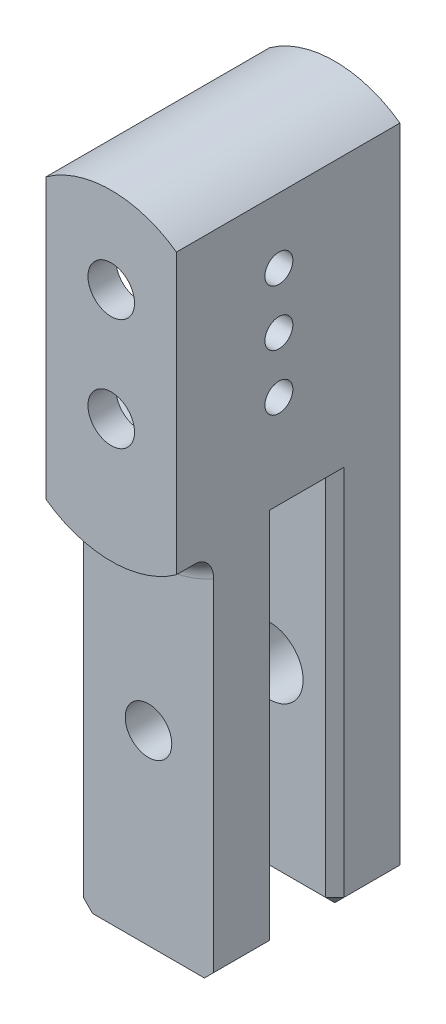
from build123d import *

# Parameters (mm, degrees)
SKETCH1_W           = 7
SKETCH1_H           = 35
BOSS_EXTRUDE1_DEPTH = 3.5
SKETCH2_W           = 7
SKETCH2_H           = 15
BOSS_EXTRUDE2_DEPTH = 3
SKETCH3_W           = 7
SKETCH3_H           = 35
BOSS_EXTRUDE3_DEPTH = 3.5
SKETCH4_W           = 7
SKETCH4_H           = 15
BOSS_EXTRUDE4_DEPTH = 2
SKETCH5_W           = 7
SKETCH5_H           = 9
CUT_EXTRUDE1_DEPTH  = 5.5
CUT_EXTRUDE2_REACH  = 39.407
SKETCH6_R           = 0.75
CUT_EXTRUDE3_REACH  = 39.656
SKETCH7_R           = 1.25
BOSS_EXTRUDE5_DEPTH = 12
BOSS_EXTRUDE6_DEPTH = 2
CHAMFER1_SIZE       = 0.5
CUT_EXTRUDE4_REACH  = 39.068
SKETCH11_R          = 1.25
CUT_EXTRUDE5_REACH  = 39.656
SKETCH12_R          = 1.8
FILLET1_R           = 1


with BuildPart() as part:
    # Sketch1 → Boss-Extrude1 (new body)
    with BuildSketch(Plane.XY):
        with Locations((3.5, -17.5)):
            Rectangle(SKETCH1_W, SKETCH1_H)
    extrude(amount=BOSS_EXTRUDE1_DEPTH)

    # Sketch2 → Boss-Extrude2 (add)
    with BuildSketch(Plane.XY.offset(3.5)):
        with Locations((3.5, -7.5)):
            Rectangle(SKETCH2_W, SKETCH2_H)
    extrude(amount=BOSS_EXTRUDE2_DEPTH)

    # Sketch3 → Boss-Extrude3 (add)
    with BuildSketch(Plane.XY.offset(6.5)):
        with Locations((3.5, -17.5)):
            Rectangle(SKETCH3_W, SKETCH3_H)
    extrude(amount=BOSS_EXTRUDE3_DEPTH)

    # Sketch4 → Boss-Extrude4 (add)
    with BuildSketch(Plane.XY.offset(10)):
        with Locations((3.5, -7.5)):
            Rectangle(SKETCH4_W, SKETCH4_H)
    extrude(amount=BOSS_EXTRUDE4_DEPTH)

    # Sketch5 → Cut-Extrude1 (cut)
    with BuildSketch(Plane.ZY):
        with Locations((7, -6.5)):
            Rectangle(SKETCH5_W, SKETCH5_H)
    extrude(amount=-CUT_EXTRUDE1_DEPTH, mode=Mode.SUBTRACT)

    # Sketch6 → Cut-Extrude2 (cut, up to next)
    with BuildSketch(Plane.ZY.offset(-5.5), mode=Mode.PRIVATE) as cut_extrude2_sk1:
        with Locations((6.5, -3.5)):
            Circle(SKETCH6_R)
    cut_extrude2_tool1 = extrude(cut_extrude2_sk1.sketch, amount=-CUT_EXTRUDE2_REACH, mode=Mode.PRIVATE) & part.part
    # Sketch6 → Cut-Extrude2 (cut, up to next)
    with BuildSketch(Plane.ZY.offset(-5.5), mode=Mode.PRIVATE) as cut_extrude2_sk2:
        with Locations((6.5, -9.5)):
            Circle(SKETCH6_R)
    cut_extrude2_tool2 = extrude(cut_extrude2_sk2.sketch, amount=-CUT_EXTRUDE2_REACH, mode=Mode.PRIVATE) & part.part
    # Sketch6 → Cut-Extrude2 (cut, up to next)
    with BuildSketch(Plane.ZY.offset(-5.5), mode=Mode.PRIVATE) as cut_extrude2_sk3:
        with Locations((6.5, -6.5)):
            Circle(SKETCH6_R)
    cut_extrude2_tool3 = extrude(cut_extrude2_sk3.sketch, amount=-CUT_EXTRUDE2_REACH, mode=Mode.PRIVATE) & part.part
    add(cut_extrude2_tool1.solids().sort_by_distance((5.5, -3.5, 6.5))[0], mode=Mode.SUBTRACT)
    add(cut_extrude2_tool2.solids().sort_by_distance((5.5, -9.5, 6.5))[0], mode=Mode.SUBTRACT)
    add(cut_extrude2_tool3.solids().sort_by_distance((5.5, -6.5, 6.5))[0], mode=Mode.SUBTRACT)

    # Sketch7 → Cut-Extrude3 (cut, up to next)
    with BuildSketch(Plane.XY.offset(12), mode=Mode.PRIVATE) as cut_extrude3_sk1:
        with Locations((3.5, -3.5)):
            Circle(SKETCH7_R)
    cut_extrude3_tool1 = extrude(cut_extrude3_sk1.sketch, amount=-CUT_EXTRUDE3_REACH, mode=Mode.PRIVATE) & part.part
    # Sketch7 → Cut-Extrude3 (cut, up to next)
    with BuildSketch(Plane.XY.offset(12), mode=Mode.PRIVATE) as cut_extrude3_sk2:
        with Locations((3.5, -9.5)):
            Circle(SKETCH7_R)
    cut_extrude3_tool2 = extrude(cut_extrude3_sk2.sketch, amount=-CUT_EXTRUDE3_REACH, mode=Mode.PRIVATE) & part.part
    add(cut_extrude3_tool1.solids().sort_by_distance((3.5, -3.5, 12))[0], mode=Mode.SUBTRACT)
    add(cut_extrude3_tool2.solids().sort_by_distance((3.5, -9.5, 12))[0], mode=Mode.SUBTRACT)

    # Sketch9 → Boss-Extrude5 (add)
    with BuildSketch(Plane.XY.offset(12)):
        with BuildLine():
            Line((0, 0), (7, 0))
            ThreePointArc((7, 0), (3.5, 1.126602828), (0, 0))
        make_face()
    extrude(amount=-BOSS_EXTRUDE5_DEPTH)

    # Sketch10 → Boss-Extrude6 (add)
    with BuildSketch(Plane.XY.offset(12)):
        with BuildLine():
            Line((0, -15), (7, -15))
            ThreePointArc((7, -15), (3.5, -16.126602828), (0, -15))
        make_face()
    extrude(amount=-BOSS_EXTRUDE6_DEPTH)

    # Chamfer1
    chamfer1_edges = [part.edges().sort_by_distance(p)[0] for p in [
        (7, -25, 3.5),
        (0, -25, 3.5),
        (0, -15, 5),
        (7, -15, 5),
        (0, -25, 6.5),
        (3.5, -35, 6.5),
        (0, -35, 8.25),
        (7, -25, 6.5),
        (7, -35, 8.25),
        (7, -35, 1.75),
        (0, -35, 1.75),
        (3.5, -35, 3.5),
    ]]
    chamfer(chamfer1_edges, length=CHAMFER1_SIZE)

    # Sketch11 → Cut-Extrude4 (cut, up to next)
    with BuildSketch(Plane.XY.offset(10), mode=Mode.PRIVATE) as cut_extrude4_sk1:
        with Locations((3.5, -25)):
            Circle(SKETCH11_R)
    cut_extrude4_tool1 = extrude(cut_extrude4_sk1.sketch, amount=-CUT_EXTRUDE4_REACH, mode=Mode.PRIVATE) & part.part
    add(cut_extrude4_tool1.solids().sort_by_distance((3.5, -25, 10))[0], mode=Mode.SUBTRACT)

    # Sketch12 → Cut-Extrude5 (cut, up to next)
    with BuildSketch(Plane(origin=(0, 0, 0), x_dir=(-1, 0, 0), z_dir=(0, 0, -1)), mode=Mode.PRIVATE) as cut_extrude5_sk1:
        with Locations((-3.5, -25)):
            Circle(SKETCH12_R)
    cut_extrude5_tool1 = extrude(cut_extrude5_sk1.sketch, amount=-CUT_EXTRUDE5_REACH, mode=Mode.PRIVATE) & part.part
    add(cut_extrude5_tool1.solids().sort_by_distance((3.5, -25, 0))[0], mode=Mode.SUBTRACT)

    # Fillet1
    fillet1_edges = [part.edges().sort_by_distance(p)[0] for p in [
        (3.5, -16.126602828, 10),
    ]]
    fillet(fillet1_edges, radius=FILLET1_R)


solid = part.part
